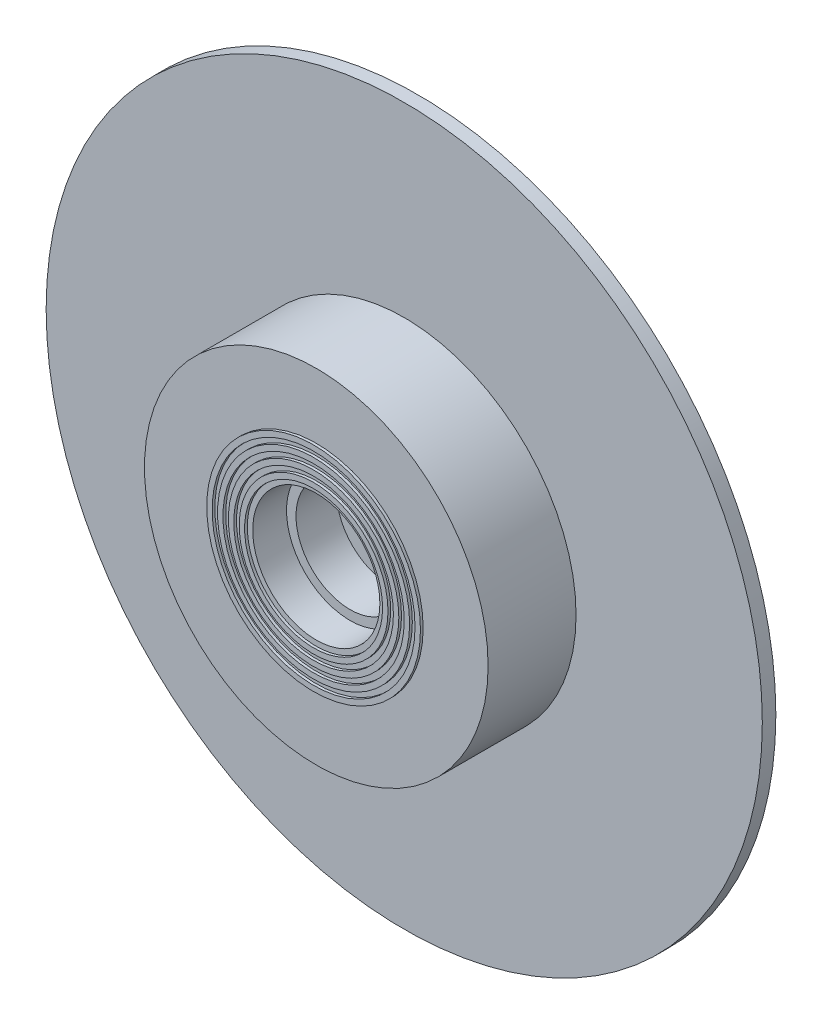
from build123d import *


with BuildPart() as part:
    # Sketch1 → Revolve1 (revolve)
    with BuildSketch(Plane.YZ, mode=Mode.PRIVATE) as revolve1_sk:
        Polygon((-28.5, 32.5), (-28.5, 5), (-12.1, 5), (-12.1, 10), (-20, 10), (-20, 25), (-23.5, 25), (-23.5, 37.5), (-25.5, 37.5), (-25.5, 38.5), (-27.5, 38.5), (-27.5, 37.5), (-29.5, 37.5), (-29.5, 38.5), (-31.5, 38.5), (-31.5, 37.5), (-33.5, 37.5), (-33.5, 38.5), (-35.5, 38.5), (-35.5, 37.5), (-37.5, 37.5), (-37.5, 38.5), (-39.5, 38.5), (-39.5, 37.5), (-63.5, 37.5), (-63.5, 5), (-132.334, 5), (-132.334, 0), (-60.5, 0), (-60.5, 32.5), align=None)
    revolve(revolve1_sk.sketch.rotate(Axis((0, 0, 1538.348894466), (0, 0, -1)), 270), axis=Axis((0, 0, 1538.348894466), (0, 0, -1)))


solid = part.part
